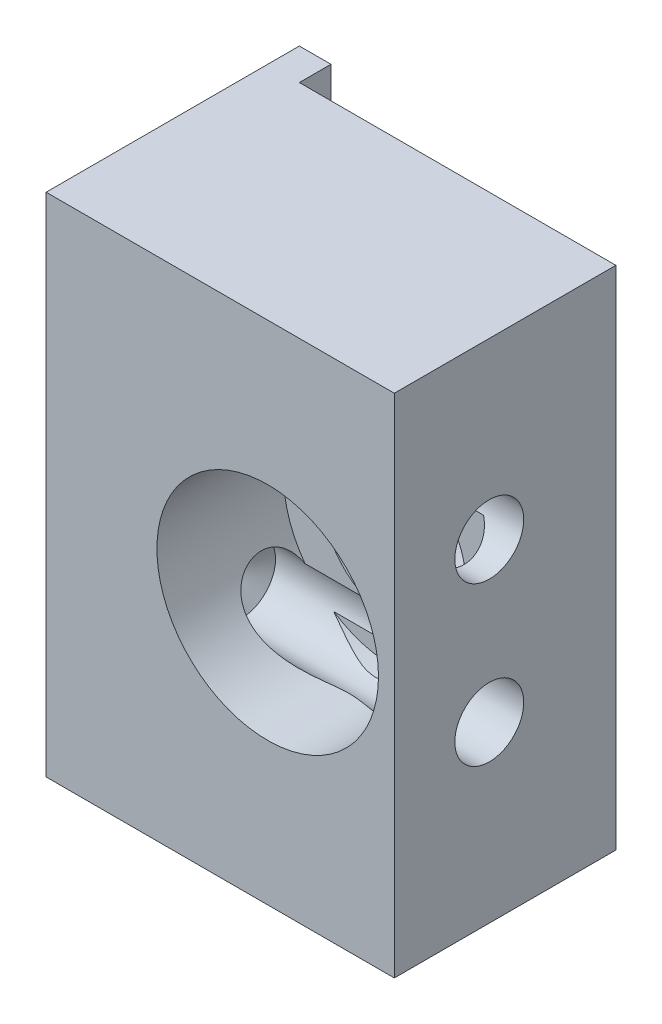
from build123d import *

# Parameters (mm, degrees)
SKETCH1_W                                        = 17.4625
SKETCH1_H                                        = 25.4
BOSS_EXTRUDE1_DEPTH                              = 12.7
SKETCH2_W                                        = 15.875
SKETCH2_H                                        = 1.5875
CUT_EXTRUDE1_DEPTH                               = 34.3375
F_8_32_TAPPED_HOLE1_D                            = 3.4544
F_8_32_TAPPED_HOLE1_DEPTH                        = 12.446
F_8_32_TAPPED_HOLE1_TIP                          = 1.037806461
CBORE_FOR_1_4_SOCKET_HEAD_CAP_SCREW1_D           = 7.14248
CBORE_FOR_1_4_SOCKET_HEAD_CAP_SCREW1_CBORE_D     = 11.1125
CBORE_FOR_1_4_SOCKET_HEAD_CAP_SCREW1_CBORE_DEPTH = 6.35


with BuildPart() as part:
    # Sketch1 → Boss-Extrude1 (new body)
    with BuildSketch(Plane.XY):
        with Locations((8.73125, 12.7)):
            Rectangle(SKETCH1_W, SKETCH1_H)
    extrude(amount=BOSS_EXTRUDE1_DEPTH)

    # Sketch2 → Cut-Extrude1 (cut, through all)
    with BuildSketch(Plane(origin=(0, 25.4, 0), x_dir=(1, 0, 0), z_dir=(0, 1, 0))):
        with Locations((9.525, -0.79375)):
            Rectangle(SKETCH2_W, SKETCH2_H)
    extrude(amount=-CUT_EXTRUDE1_DEPTH, mode=Mode.SUBTRACT)

    # #8-32 Tapped Hole1
    with Locations(Plane(origin=(17.4625, 0, 0), x_dir=(0, 0, -1), z_dir=(1, 0, 0))):
        with Locations((-7.9375, 16.66875), (-7.9375, 8.73125)):
            Hole(F_8_32_TAPPED_HOLE1_D / 2, depth=F_8_32_TAPPED_HOLE1_DEPTH)
            with Locations((0, 0, -(F_8_32_TAPPED_HOLE1_DEPTH + F_8_32_TAPPED_HOLE1_TIP / 2))):  # 118° drill point
                Cone(0, F_8_32_TAPPED_HOLE1_D / 2, F_8_32_TAPPED_HOLE1_TIP, mode=Mode.SUBTRACT)

    # CBORE for 1/4 Socket Head Cap Screw1 (through all)
    with Locations(Plane.XY.offset(12.7)):
        with Locations((11.1125, 12.7)):
            CounterBoreHole(CBORE_FOR_1_4_SOCKET_HEAD_CAP_SCREW1_D / 2, CBORE_FOR_1_4_SOCKET_HEAD_CAP_SCREW1_CBORE_D / 2, CBORE_FOR_1_4_SOCKET_HEAD_CAP_SCREW1_CBORE_DEPTH)


solid = part.part
